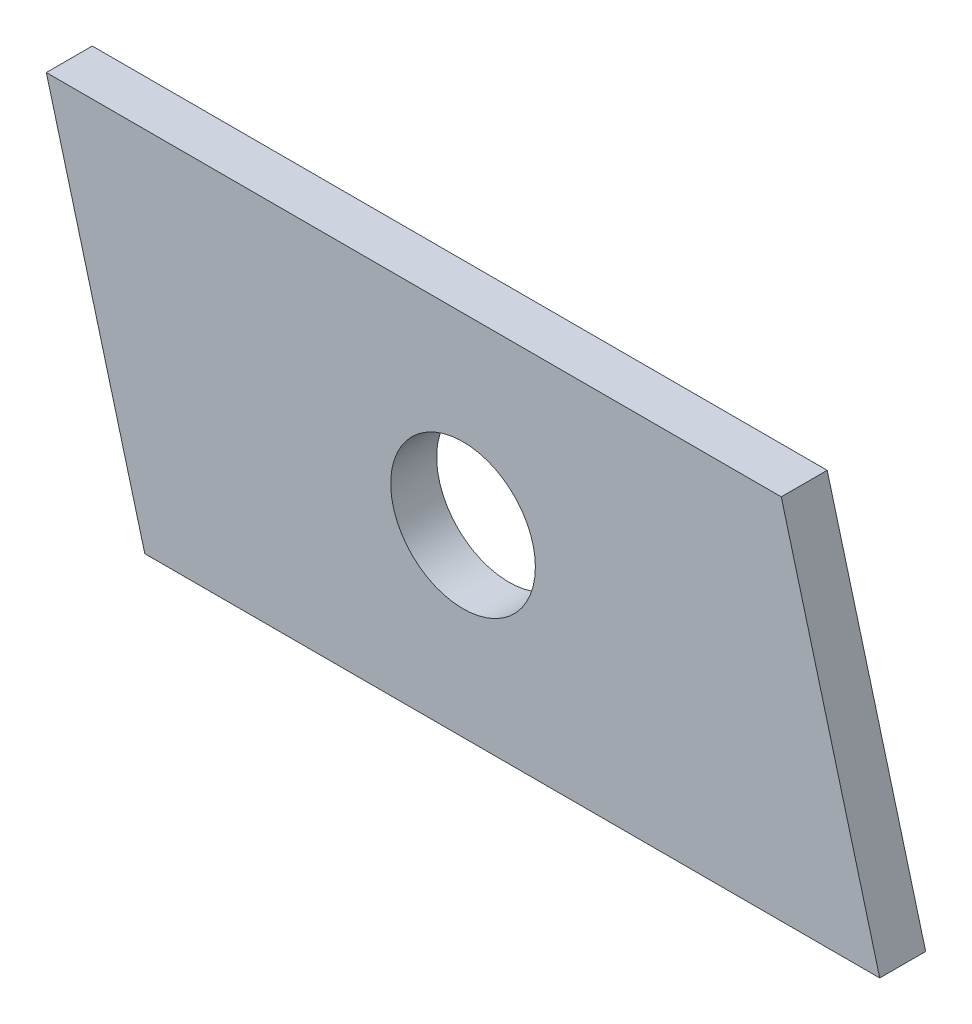
from build123d import *

# Parameters (mm, degrees)
SKETCH1_R           = 5
BOSS_EXTRUDE1_DEPTH = 3.175


with BuildPart() as part:
    # Sketch1 → Boss-Extrude1 (new body)
    with BuildSketch(Plane.XY):
        Polygon((-218.70690504, 117.173081746), (-211.900995552, 91.773081746), (-161.100995552, 91.773081746), (-167.90690504, 117.173081746), align=None)
        with Locations((-189.903950296, 104.473081746)):
            Circle(SKETCH1_R, mode=Mode.SUBTRACT)
    extrude(amount=-BOSS_EXTRUDE1_DEPTH)


solid = part.part
